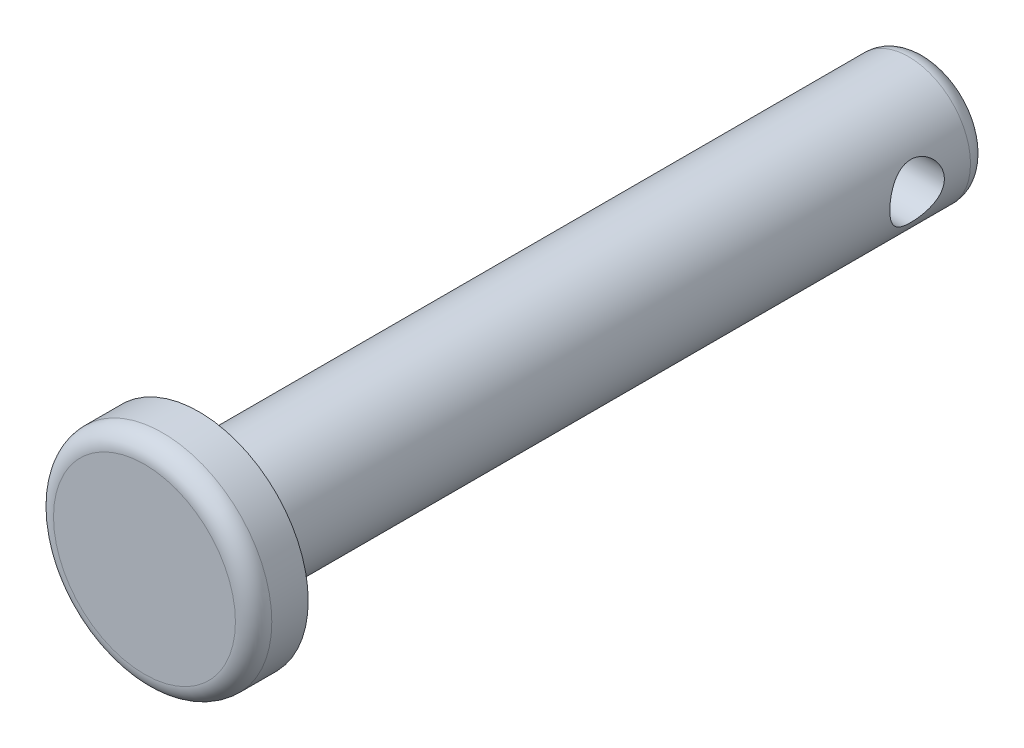
from build123d import *

# Parameters (mm, degrees)
FILLET2_R               = 5
FILLET3_R               = 5
CUT_EXTRUDE1_DEPTH      = 20
CUT_EXTRUDE1_DEPTH_BACK = 20
SKETCH5_R               = 7.5


with BuildPart() as part:
    # Sketch4 → Revolve1 (revolve)
    with BuildSketch(Plane(origin=(0, 0, 0), x_dir=(0, 0, -1), z_dir=(1, 0, 0))):
        Polygon((-215.028448312, -8.762321339), (0, -8.762321339), (0, 8.237678661), (-200.028448312, 8.237678661), (-200.028448312, 21.237678661), (-215.028448312, 21.237678661), align=None)
    revolve(axis=Axis((0, -8.762321339, 221.52106333), (0, 0, -1)))

    # Fillet2
    fillet2_edges = [part.edges().sort_by_distance(p)[0] for p in [
        (0, -25.762321339, 0),
    ]]
    fillet(fillet2_edges, radius=FILLET2_R)

    # Fillet3
    fillet3_edges = [part.edges().sort_by_distance(p)[0] for p in [
        (0, -38.762321339, 215.028448312),
    ]]
    fillet(fillet3_edges, radius=FILLET3_R)

    # Sketch5 → Cut-Extrude1 (cut, two sides: drawn at the far end of the back side and taken through both)
    with BuildSketch(Plane(origin=(0, 0, 0), x_dir=(0, 0, -1), z_dir=(1, 0, 0)).offset(-CUT_EXTRUDE1_DEPTH_BACK)):
        with Locations((-19.67963909, -8.762321339)):
            Circle(SKETCH5_R)
    extrude(amount=CUT_EXTRUDE1_DEPTH + CUT_EXTRUDE1_DEPTH_BACK, mode=Mode.SUBTRACT)


solid = part.part
